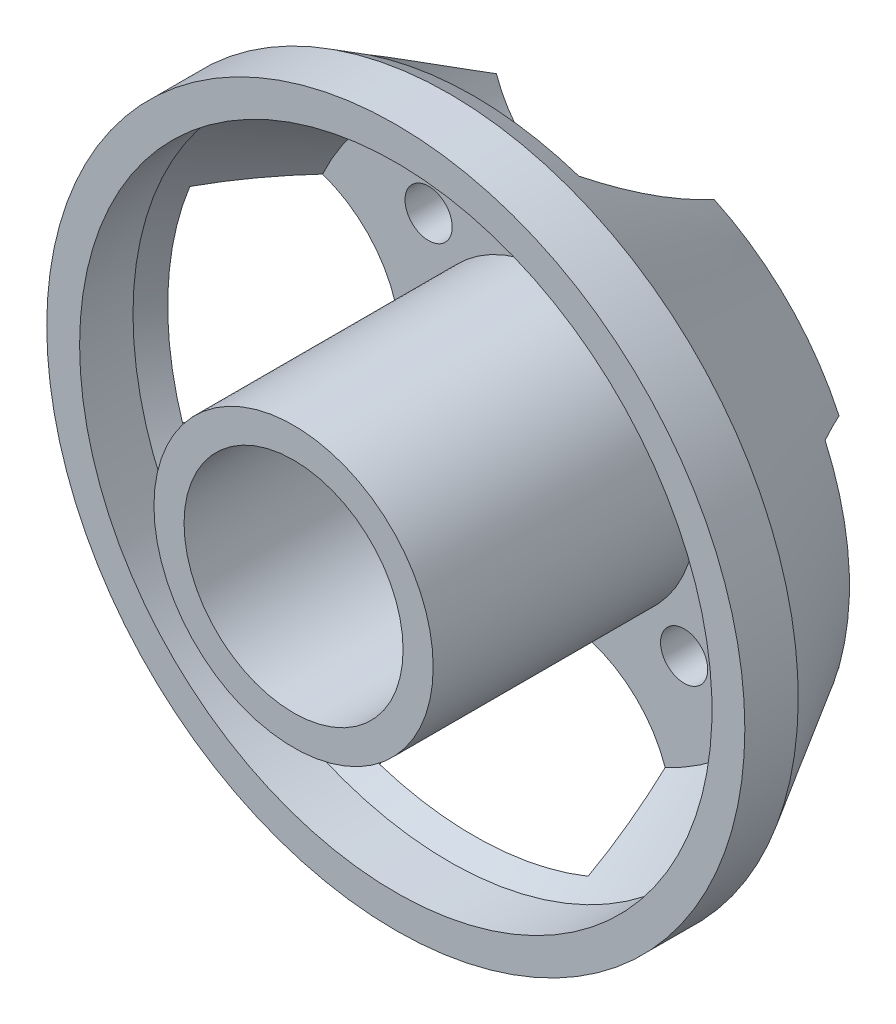
from build123d import *

# Parameters (mm, degrees)
SKETCH1_R                   = 21.25
SKETCH1_R_2                 = 19.25
BOSS_EXTRUDE1_DEPTH         = 3.25
SKETCH4_R                   = 7
CUT_EXTRUDE2_DEPTH          = 8
SKETCH5_R                   = 7
CUT_EXTRUDE3_DEPTH          = 2
SKETCH7_R                   = 8.5
BOSS_EXTRUDE2_DEPTH         = 16
SKETCH6_R                   = 6.6675
CUT_EXTRUDE5_DEPTH          = 36.540444334
F_33_0_113_DIAMETER_HOLE1_D = 2.8702


with BuildPart() as part:
    # Sketch1 → Boss-Extrude1 (new body)
    with BuildSketch(Plane.XY):
        with Locations(Location((0, 0, 0), (0, 0, 180))):
            Circle(SKETCH1_R)
        with Locations(Location((0, 0, 0), (0, 0, 180))):
            Circle(SKETCH1_R_2, mode=Mode.SUBTRACT)
    extrude(amount=BOSS_EXTRUDE1_DEPTH)

    # Sketch2 → Revolve1 (revolve)
    with BuildSketch(Plane(origin=(0, 0, 0), x_dir=(1, 0, 0), z_dir=(0, 1, 0))):
        Polygon((-21.25, 0), (-15.7, 9.5), (0, 9.5), (0, 6.526382134), (-15.7, 6.526382134), (-19.512781141, 0), align=None)
    revolve(axis=Axis((0, 0, -9.5), (0, 0, 1)))

    # Sketch4 → Cut-Extrude2 (cut)
    with BuildSketch(Plane(origin=(0, 0, -9.5), x_dir=(-1, 0, 0), z_dir=(0, 0, -1))):
        with Locations((0, 16.5)):
            Circle(SKETCH4_R)
        with Locations((16.5, 0)):
            Circle(SKETCH4_R)
        with Locations((0, -16.5)):
            Circle(SKETCH4_R)
    extrude(amount=-CUT_EXTRUDE2_DEPTH, mode=Mode.SUBTRACT)

    # Sketch5 → Cut-Extrude3 (cut)
    with BuildSketch(Plane(origin=(0, 0, -9.5), x_dir=(-1, 0, 0), z_dir=(0, 0, -1))):
        with Locations((-16.5, 0)):
            Circle(SKETCH5_R)
    extrude(amount=-CUT_EXTRUDE3_DEPTH, mode=Mode.SUBTRACT)

    # Sketch7 → Boss-Extrude2 (add)
    with BuildSketch(Plane.XY.offset(-6.526382134)):
        Circle(SKETCH7_R)
    extrude(amount=BOSS_EXTRUDE2_DEPTH)

    # Sketch6 → Cut-Extrude5 (cut, through all)
    with BuildSketch(Plane(origin=(0, 0, -9.5), x_dir=(-1, 0, 0), z_dir=(0, 0, -1))):
        Circle(SKETCH6_R)
    extrude(amount=-CUT_EXTRUDE5_DEPTH, mode=Mode.SUBTRACT)

    # #33 (0.113) Diameter Hole1 (through all)
    with Locations(Plane(origin=(0, 0, -9.5), x_dir=(-1, 0, 0), z_dir=(0, 0, -1))):
        with Locations((7.778174593, 7.778174593), (7.778174593, -7.778174593), (-7.778174593, -7.778174593), (-7.778174593, 7.778174593)):
            Hole(F_33_0_113_DIAMETER_HOLE1_D / 2)


solid = part.part
